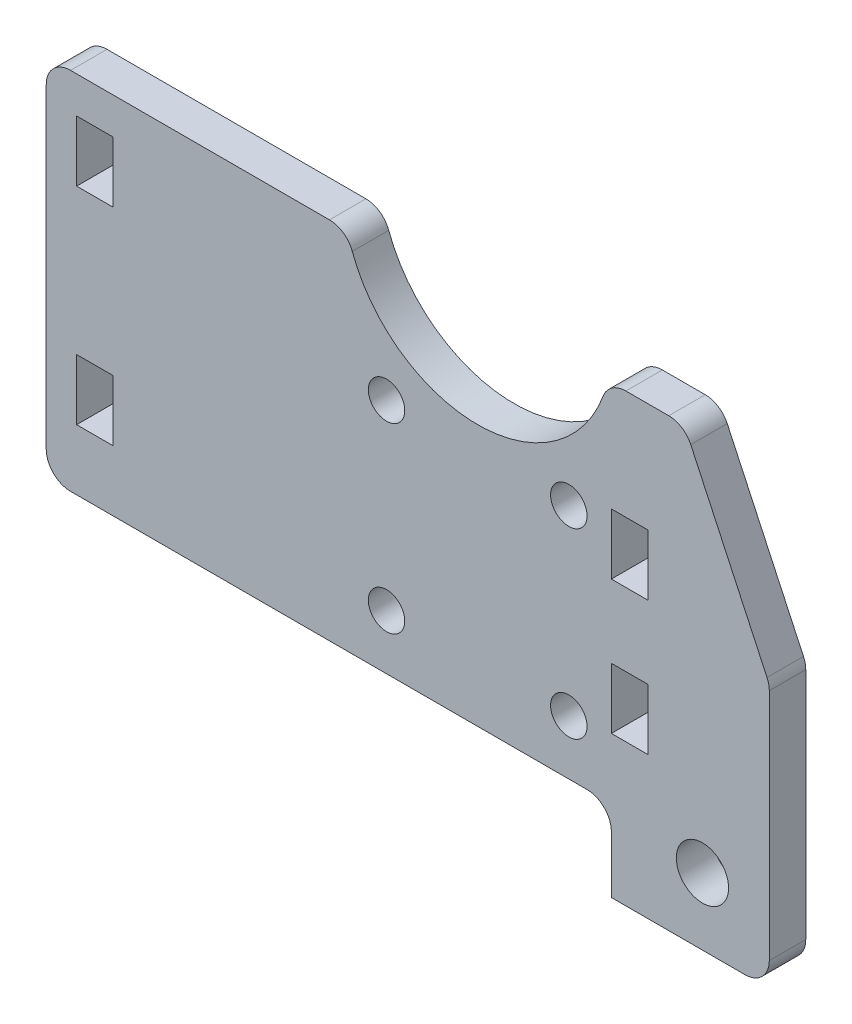
from build123d import *

# Parameters (mm, degrees)
SKETCH_1_W          = 52
SKETCH_1_H          = 30
EXTRUDE_1_DEPTH     = 3
SKETCH_2_W          = 3
SKETCH_2_H          = 5
CUT_EXTRUDE_1_DEPTH = 4
SKETCH_6_W          = 4.623864405
SKETCH_6_H          = 6.377744006
EXTRUDE_2_DEPTH     = 3
SKETCH_7_W          = 3
SKETCH_7_H          = 5
CUT_EXTRUDE_4_DEPTH = 10
SKETCH_8_R          = 2
EXTRUDE_3_DEPTH     = 3
SKETCH_9_R          = 2.25
CUT_EXTRUDE_5_DEPTH = 10
SKETCH_10_R         = 1.5
CUT_EXTRUDE_6_DEPTH = 10
SKETCH_11_R         = 11
CUT_EXTRUDE_7_DEPTH = 10
FILLET_1_R          = 2
SKETCH_12_W         = 2
SKETCH_12_H         = 36.695
EXTRUDE_4_DEPTH     = 3
FILLET_2_R          = 2
CHAMFER_1_SIZE      = 7
CHAMFER_1_SIZE2     = 15.011548444
FILLET_3_R          = 2
EXTRUDE_START       = -3
SKETCH_13_R         = 2.25
SKETCH_13_R_2       = 2.15
EXTRUDE_5_DEPTH     = 3
FILLET_4_R          = 2


with BuildPart() as part:
    # 草图1 → 凸台-拉伸1 (new body)
    with BuildSketch(Plane.XY):
        Rectangle(SKETCH_1_W, SKETCH_1_H)
    extrude(amount=EXTRUDE_1_DEPTH)

    # 草图2 → 切除-拉伸1 (cut)
    with BuildSketch(Plane.XY.offset(3)):
        with Locations((22, -7.5)):
            Rectangle(SKETCH_2_W, SKETCH_2_H)
        with Locations((22, 9.5)):
            Rectangle(SKETCH_2_W, SKETCH_2_H)
        with Locations((-22, 9.5)):
            Rectangle(SKETCH_2_W, SKETCH_2_H)
        with Locations((-22, -7.5)):
            Rectangle(SKETCH_2_W, SKETCH_2_H)
    extrude(amount=-CUT_EXTRUDE_1_DEPTH, mode=Mode.SUBTRACT)

    # 草图6 → 凸台-拉伸2 (add)
    with BuildSketch(Plane(origin=(0, 0, 0), x_dir=(-1, 0, 0), z_dir=(0, 0, -1))):
        with Locations((-21.865764725, 9.519388139)):
            Rectangle(SKETCH_6_W, SKETCH_6_H)
    extrude(amount=-EXTRUDE_2_DEPTH)

    # 草图7 → 切除-拉伸4 (cut)
    with BuildSketch(Plane(origin=(0, 0, 0), x_dir=(-1, 0, 0), z_dir=(0, 0, -1))):
        with Locations((-22, 3.5)):
            Rectangle(SKETCH_7_W, SKETCH_7_H)
    extrude(amount=-CUT_EXTRUDE_4_DEPTH, mode=Mode.SUBTRACT)

    # 草图8 → 凸台-拉伸3 (add)
    with BuildSketch(Plane.XY.offset(3)):
        Polygon((26, 15), (31.495, 15), (31.495, -21.695), (20.5, -21.695), (20.5, -15), (26, -15), align=None)
        with Locations((27.995, -16.195)):
            Circle(SKETCH_8_R, mode=Mode.SUBTRACT)
    extrude(amount=-EXTRUDE_3_DEPTH)

    # 草图9 → 切除-拉伸5 (cut)
    with BuildSketch(Plane.XY.offset(3)):
        with Locations((27.995, -16.195)):
            Circle(SKETCH_9_R)
    extrude(amount=-CUT_EXTRUDE_5_DEPTH, mode=Mode.SUBTRACT)

    # 草图10 → 切除-拉伸6 (cut)
    with BuildSketch(Plane(origin=(0, 0, 0), x_dir=(-1, 0, 0), z_dir=(0, 0, -1))):
        with Locations((-17, 4.5)):
            Circle(SKETCH_10_R)
        with Locations((-2, 4.5)):
            Circle(SKETCH_10_R)
        with Locations((-17, -10.5)):
            Circle(SKETCH_10_R)
        with Locations((-2, -10.5)):
            Circle(SKETCH_10_R)
    extrude(amount=-CUT_EXTRUDE_6_DEPTH, mode=Mode.SUBTRACT)

    # 草图11 → 切除-拉伸7 (cut)
    with BuildSketch(Plane(origin=(0, 0, 0), x_dir=(-1, 0, 0), z_dir=(0, 0, -1))):
        with Locations((-9.5, 17.5)):
            Circle(SKETCH_11_R)
    extrude(amount=-CUT_EXTRUDE_7_DEPTH, mode=Mode.SUBTRACT)

    # 圆角1
    fillet_1_edges = [part.edges().sort_by_distance(p)[0] for p in [
        (20.5, -15, 1.5),
        (-1.212142643, 15, 1.5),
        (20.212142643, 15, 1.5),
    ]]
    fillet(fillet_1_edges, radius=FILLET_1_R)

    # 草图12 → 凸台-拉伸4 (add)
    with BuildSketch(Plane(origin=(0, 0, 0), x_dir=(-1, 0, 0), z_dir=(0, 0, -1))):
        with Locations((-32.495, -3.3475)):
            Rectangle(SKETCH_12_W, SKETCH_12_H)
    extrude(amount=-EXTRUDE_4_DEPTH)

    # 圆角2
    fillet_2_edges = [part.edges().sort_by_distance(p)[0] for p in [
        (33.495, -21.695, 1.5),
    ]]
    fillet(fillet_2_edges, radius=FILLET_2_R)

    # 倒角1
    chamfer_1_edges = [part.edges().sort_by_distance(p)[0] for p in [
        (33.495, 15, 1.5),
    ]]
    chamfer_1_side = [part.faces().sort_by_distance(p)[0] for p in [
        (27.595655459, 15, 1.5),
    ]]
    chamfer(chamfer_1_edges, length=CHAMFER_1_SIZE, length2=CHAMFER_1_SIZE2, reference=chamfer_1_side[0])

    # 圆角3
    fillet_3_edges = [part.edges().sort_by_distance(p)[0] for p in [
        (26.495, 15, 1.5),
        (33.495, -0.011548444, 1.5),
    ]]
    fillet(fillet_3_edges, radius=FILLET_3_R)

    # 草图13 → 凸台-拉伸5 (add)
    with BuildSketch(Plane(origin=(0, 0, 0), x_dir=(-1, 0, 0), z_dir=(0, 0, -1)).offset(EXTRUDE_START)):
        with Locations((-27.995, -16.195)):
            Circle(SKETCH_13_R)
        with Locations((-27.995, -16.195)):
            Circle(SKETCH_13_R_2, mode=Mode.SUBTRACT)
    extrude(amount=EXTRUDE_5_DEPTH)

    # 圆角4
    fillet_4_edges = [part.edges().sort_by_distance(p)[0] for p in [
        (-26, -15, 1.5),
        (-26, 15, 1.5),
    ]]
    fillet(fillet_4_edges, radius=FILLET_4_R)


solid = part.part
